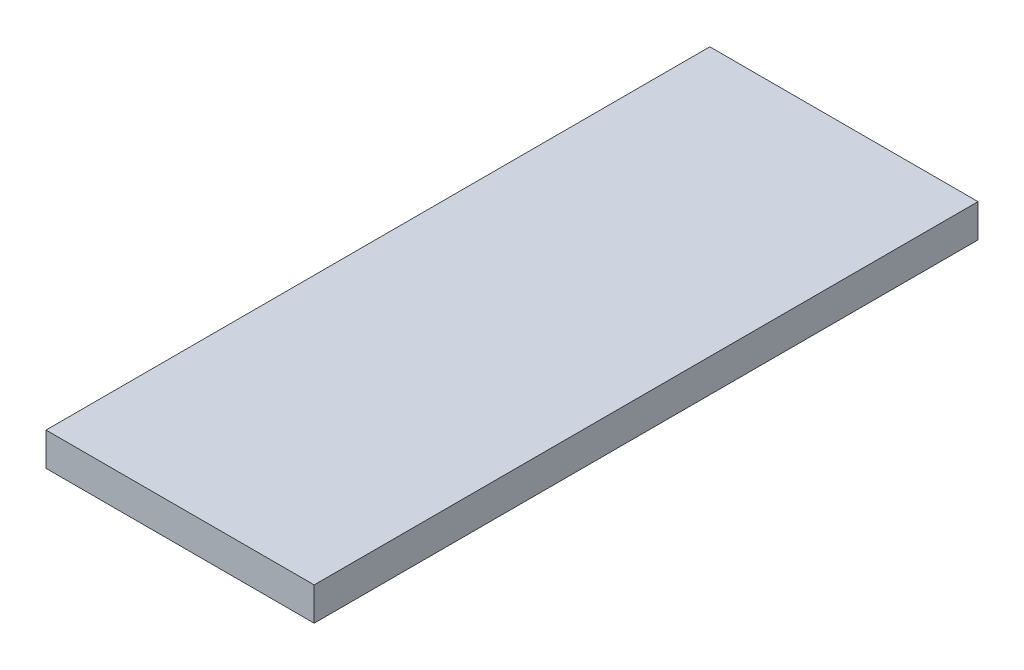
from build123d import *

# Parameters (mm, degrees)
SKETCH1_W           = 12.827
SKETCH1_H           = 31.75
BOSS_EXTRUDE1_DEPTH = 1.5875


with BuildPart() as part:
    # Sketch1 → Boss-Extrude1 (new body)
    with BuildSketch(Plane(origin=(0, 0, 0), x_dir=(1, 0, 0), z_dir=(0, 1, 0))):
        Rectangle(SKETCH1_W, SKETCH1_H)
    extrude(amount=BOSS_EXTRUDE1_DEPTH)


solid = part.part
